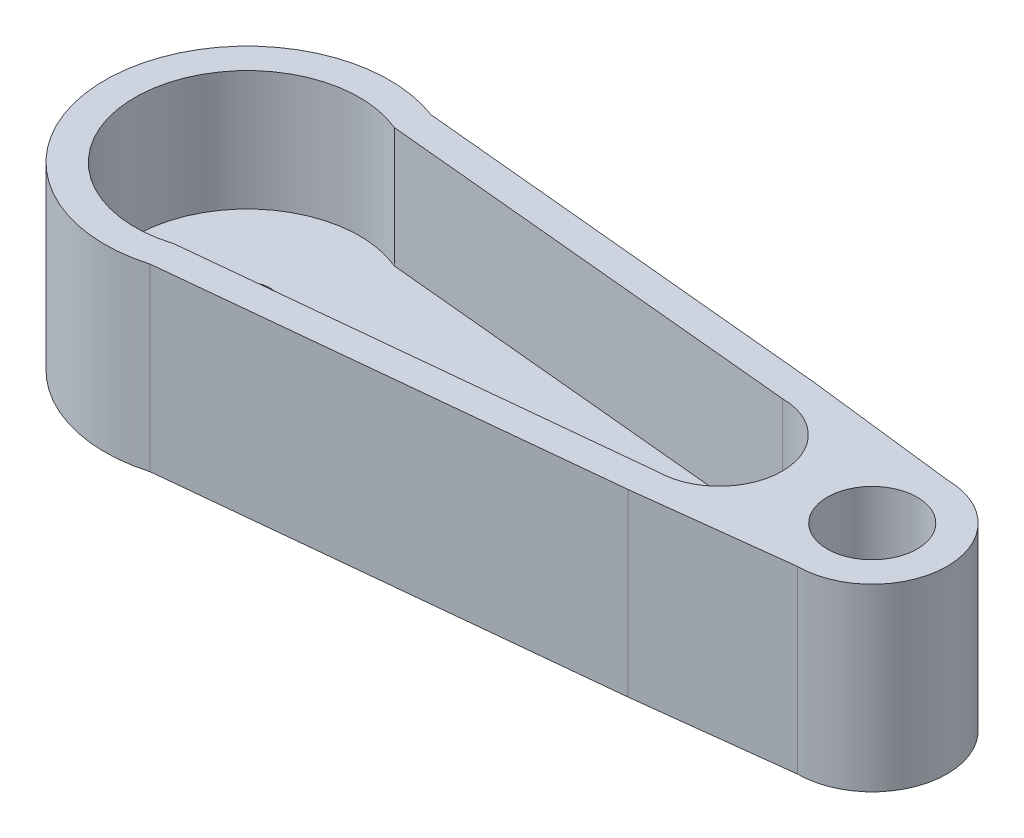
from build123d import *

# Parameters (mm, degrees)
SKETCH2_W           = 30
SKETCH2_H           = 10
BOSS_EXTRUDE3_DEPTH = 6
CUT_EXTRUDE2_DEPTH  = 4
SKETCH5_W           = 30
SKETCH5_H           = 10
CUT_EXTRUDE3_DEPTH  = 33.186953879
SKETCH6_R           = 1.5
CUT_EXTRUDE4_DEPTH  = 31.574253478
SKETCH7_R           = 0.75
CUT_EXTRUDE5_DEPTH  = 31.245412474


with BuildPart() as part:
    # Sketch2 → Boss-Extrude3 (new body)
    with BuildSketch(Plane(origin=(0, 0, 0), x_dir=(1, 0, 0), z_dir=(0, 1, 0))):
        with Locations((15, 5)):
            Rectangle(SKETCH2_W, SKETCH2_H)
    extrude(amount=BOSS_EXTRUDE3_DEPTH)

    # Sketch3 → Cut-Extrude2 (cut)
    with BuildSketch(Plane(origin=(0, 6, 0), x_dir=(1, 0, 0), z_dir=(0, 1, 0))):
        with BuildLine():
            Line((6.127698587, 1.42357778), (20.75, 2.9))
            ThreePointArc((20.75, 2.9), (22.85, 5), (20.75, 7.1))
            Line((20.75, 7.1), (6.45010187, 8.45828058))
            ThreePointArc((6.45010187, 8.45828058), (1.253932106, 5.171683811), (6.127698587, 1.42357778))
        make_face()
    extrude(amount=-CUT_EXTRUDE2_DEPTH, mode=Mode.SUBTRACT)

    # Sketch5 → Cut-Extrude3 (cut, through all)
    with BuildSketch(Plane(origin=(0, 6, 0), x_dir=(1, 0, 0), z_dir=(0, 1, 0))):
        with Locations((15, 5)):
            Rectangle(SKETCH5_W, SKETCH5_H)
        with BuildLine():
            Line((20.801973147, 8.099564291), (25.849999572, 7.501628842))
            ThreePointArc((25.849999572, 7.501628842), (28.349999572, 5.001628842), (25.849999572, 2.501628842))
            Line((25.849999572, 2.501628842), (20.805230344, 1.900492038))
            Line((20.805230344, 1.900492038), (6.324314639, 0.438345614))
            ThreePointArc((6.324314639, 0.438345614), (0.25385432, 5.191314364), (6.687176675, 9.440262928))
            Line((6.687176675, 9.440262928), (20.801973147, 8.099564291))
        make_face(mode=Mode.SUBTRACT)
    extrude(amount=-CUT_EXTRUDE3_DEPTH, mode=Mode.SUBTRACT)

    # Sketch6 → Cut-Extrude4 (cut, through all)
    with BuildSketch(Plane(origin=(0, 6, 0), x_dir=(1, 0, 0), z_dir=(0, 1, 0))):
        with Locations(Location((25.849999572, 5.001628842, 0), (0, 0, 270))):
            Circle(SKETCH6_R)
    extrude(amount=-CUT_EXTRUDE4_DEPTH, mode=Mode.SUBTRACT)

    # Sketch7 → Cut-Extrude5 (cut, through all)
    with BuildSketch(Plane(origin=(0, 2, 0), x_dir=(1, 0, 0), z_dir=(0, 1, 0))):
        with Locations(Location((5, 5, 0), (0, 0, 270))):
            Circle(SKETCH7_R)
    extrude(amount=-CUT_EXTRUDE5_DEPTH, mode=Mode.SUBTRACT)


solid = part.part
